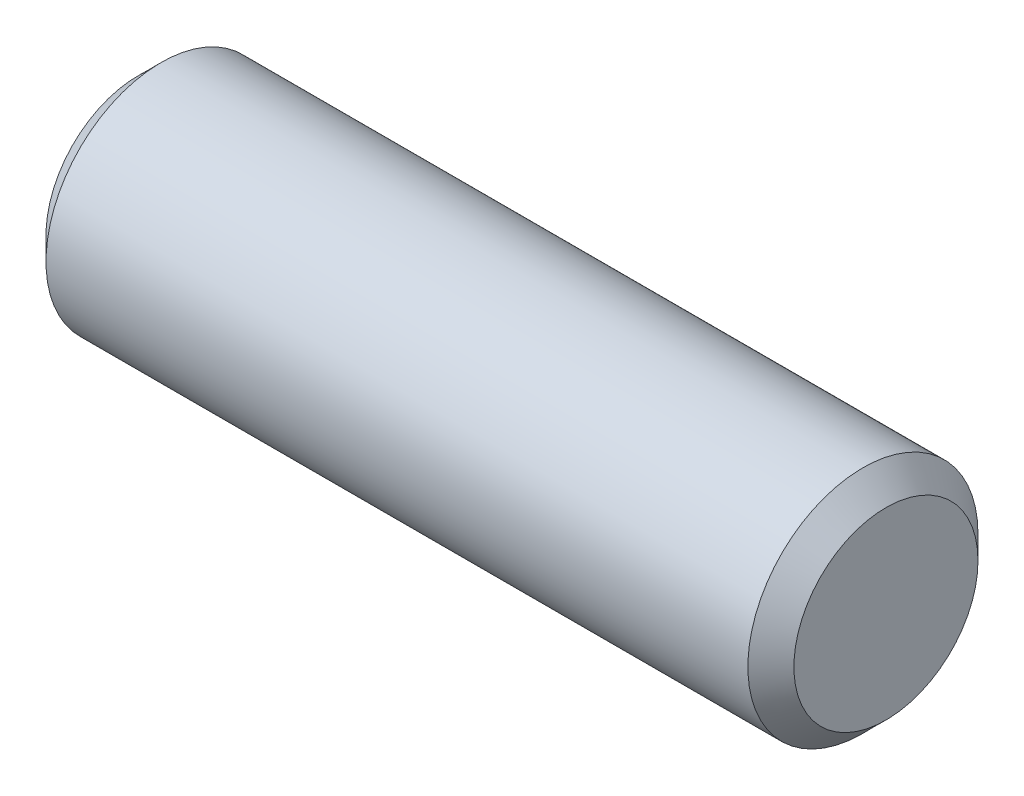
from build123d import *

# Parameters (mm, degrees)
EXTRUDE1_DEPTH      = 10.31875
EXTRUDE1_DEPTH_BACK = 10.31875
SKETCH2_R           = 3.175
CHAMFER1_SIZE       = 0.635


with BuildPart() as part:
    # Sketch2 → Extrude1 (new, two sides: drawn at the far end of the back side and taken through both)
    with BuildSketch(Plane(origin=(0, 0, 0), x_dir=(0, 0, -1), z_dir=(1, 0, 0)).offset(-EXTRUDE1_DEPTH_BACK)):
        Circle(SKETCH2_R)
    extrude(amount=EXTRUDE1_DEPTH + EXTRUDE1_DEPTH_BACK)

    # Chamfer1
    chamfer1_edges = [part.edges().sort_by_distance(p)[0] for p in [
        (-10.31875, 0, 3.175),
        (10.31875, 0, 3.175),
    ]]
    chamfer(chamfer1_edges, length=CHAMFER1_SIZE)


solid = part.part
